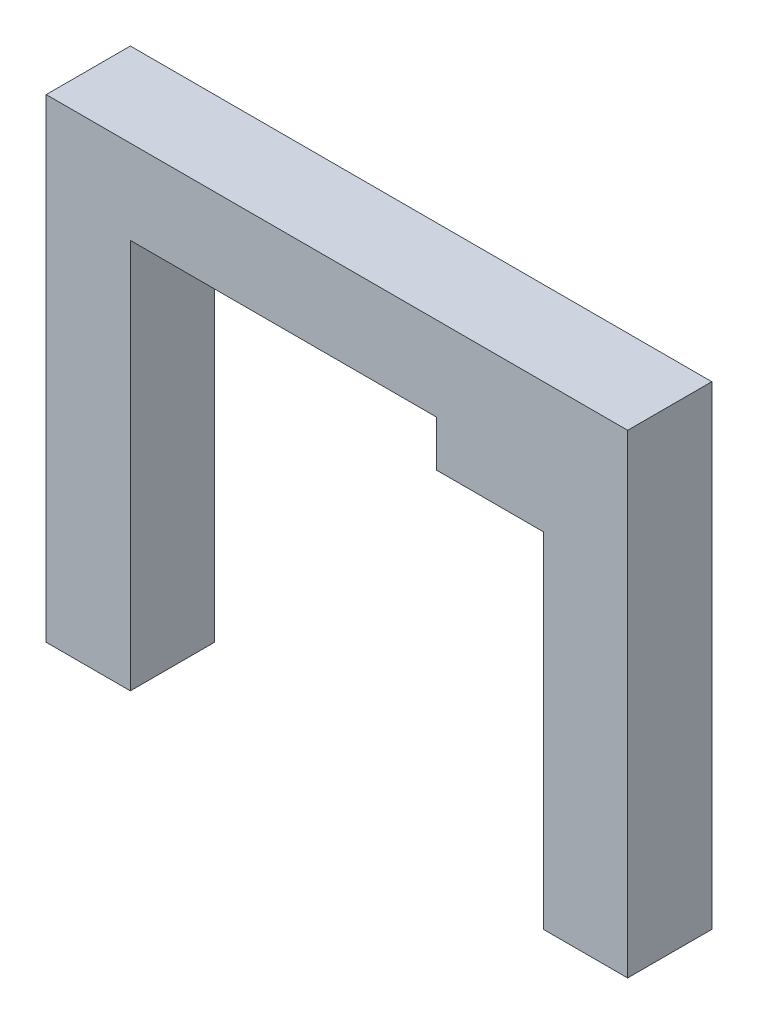
from build123d import *

# Parameters (mm, degrees)
EXTRUDE_1_DEPTH = 5.5


with BuildPart() as part:
    # ｽｹｯﾁ1 → ﾎﾞｽ - 押し出し1 (new body)
    with BuildSketch(Plane.XY):
        Polygon((0, 0), (0, 25.5), (20, 25.5), (20, 22.5), (27, 22.5), (27, 0), (32.5, 0), (32.5, 31), (-5.5, 31), (-5.5, 0), align=None)
    extrude(amount=EXTRUDE_1_DEPTH)


solid = part.part
